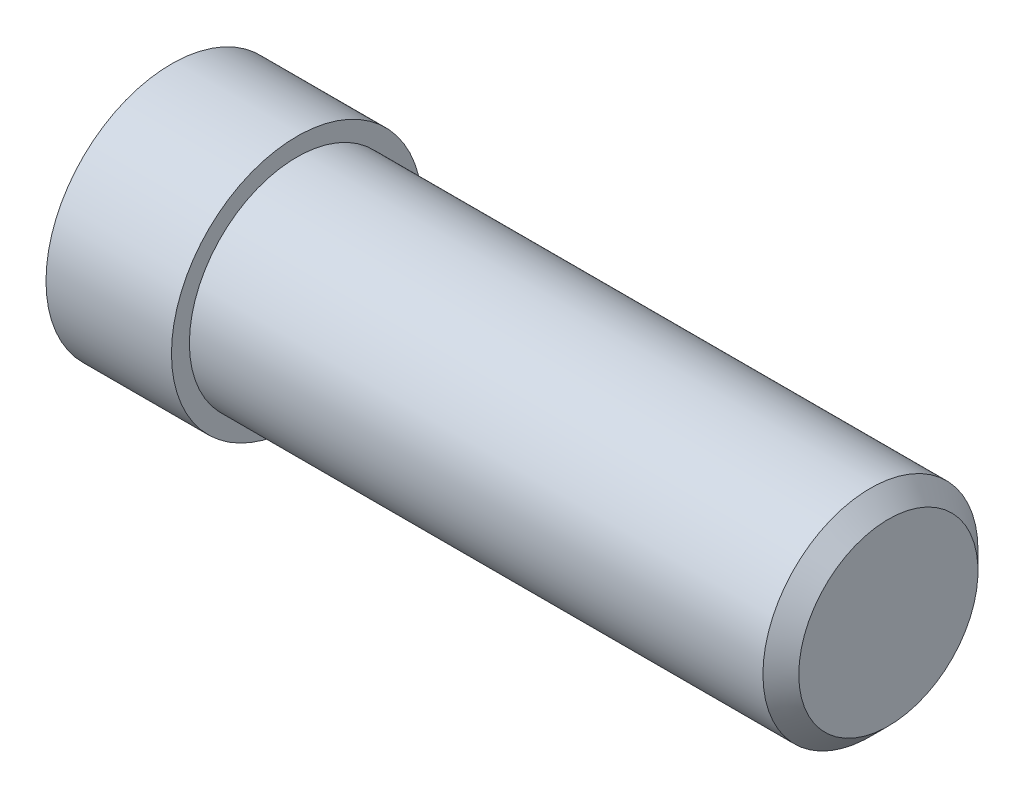
from build123d import *

# Parameters (mm, degrees)
CHAMFER1_SIZE = 1


with BuildPart() as part:
    # Sketch1 → Revolve1 (revolve)
    with BuildSketch(Plane(origin=(0, 0, 0), x_dir=(1, 0, 0), z_dir=(0, 1, 0)), mode=Mode.PRIVATE) as revolve1_sk:
        Polygon((0, 0), (40, 0), (40, 6), (7, 6), (7, 7), (0, 7), align=None)
    revolve(revolve1_sk.sketch.rotate(Axis((0, 0, 0), (1, 0, 0)), 180), axis=Axis((0, 0, 0), (1, 0, 0)))

    # Chamfer1
    chamfer1_edges = [part.edges().sort_by_distance(p)[0] for p in [
        (40, 0, -6),
    ]]
    chamfer(chamfer1_edges, length=CHAMFER1_SIZE)


solid = part.part
